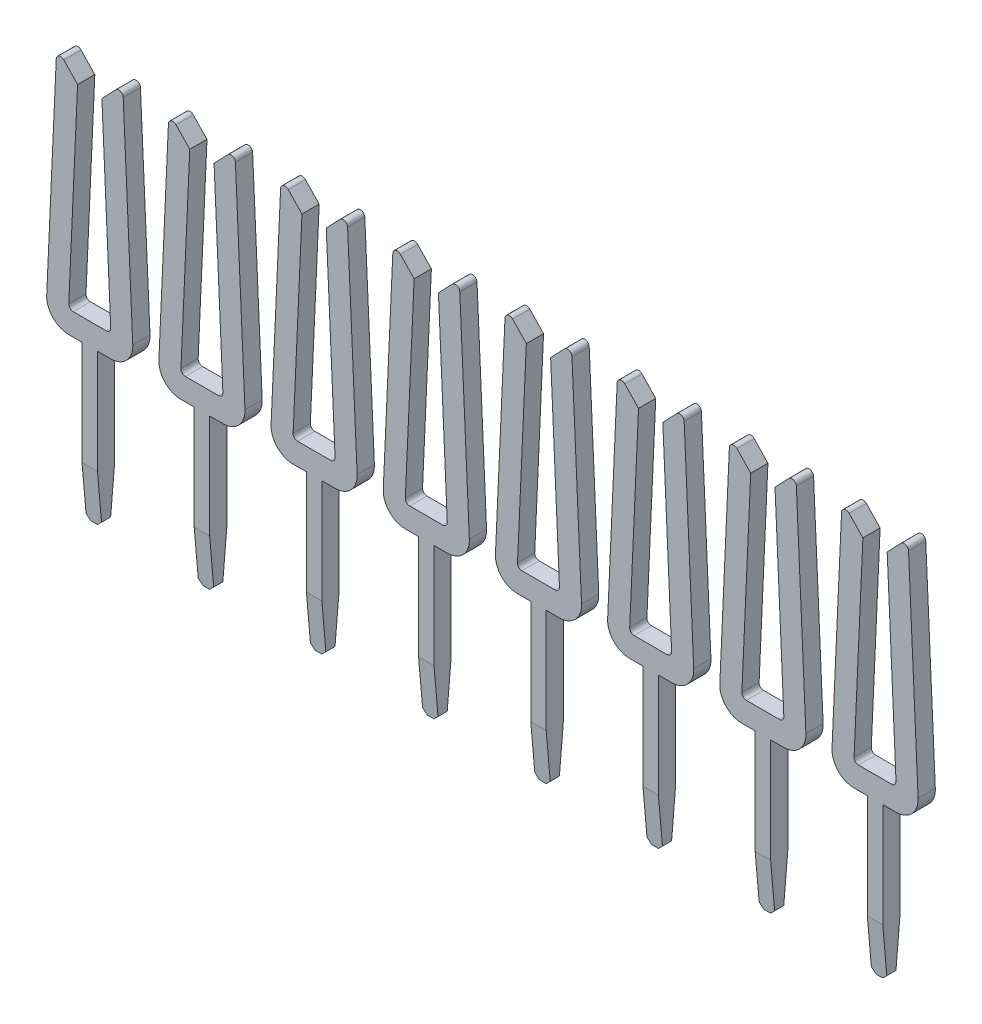
from build123d import *

# Parameters (mm, degrees)
EXTRUDE_677_DEPTH      = 0.195
CHAMFER_1_SIZE         = 0.1
CHAMFER_1_SIZE2        = 1.14300523
CHAMFER_2_SIZE         = 0.1
CHAMFER_2_SIZE2        = 1.14300523
PATTERN_LINEAR_1_COUNT = 8
PATTERN_LINEAR_1_PITCH = 2.54


with BuildPart() as part:
    # Sketch 204 → Extrude 677 (new, symmetric)
    with BuildSketch(Plane.XY):
        with BuildLine():
            Line((-0.275094226, 4.504536299), (-0.585991311, 4.829871514))
            ThreePointArc((-0.585991311, 4.829871514), (-0.693381247, 4.85442336), (-0.758184185, 4.765339295))
            Line((-0.758184185, 4.765339295), (-0.974480797, 0.022780107))
            ThreePointArc((-0.974480797, 0.022780107), (-0.836517671, -0.34540552), (-0.475, -0.5))
            Line((-0.475, -0.5), (-0.175, -0.5))
            Line((-0.175, -0.5), (-0.175, -3.9))
            Line((-0.175, -3.9), (-0.075, -4))
            Line((-0.075, -4), (0.075, -4))
            Line((0.075, -4), (0.175, -3.9))
            Line((0.175, -3.9), (0.175, -0.5))
            Line((0.175, -0.5), (0.475, -0.5))
            ThreePointArc((0.475, -0.5), (0.836517671, -0.34540552), (0.974480797, 0.022780107))
            Line((0.974480797, 0.022780107), (0.758184185, 4.765339295))
            ThreePointArc((0.758184185, 4.765339295), (0.693381247, 4.85442336), (0.585991311, 4.829871514))
            Line((0.585991311, 4.829871514), (0.275094226, 4.504536299))
            Line((0.275094226, 4.504536299), (0.474897057, 0.104536299))
            ThreePointArc((0.474897057, 0.104536299), (0.447296715, 0.030911759), (0.375, 0))
            Line((0.375, 0), (-0.375, 0))
            ThreePointArc((-0.375, 0), (-0.447296715, 0.030911759), (-0.474897057, 0.104536299))
            Line((-0.474897057, 0.104536299), (-0.275094226, 4.504536299))
        make_face()
    extrude(amount=EXTRUDE_677_DEPTH, both=True)

    # Фаска1
    chamfer_1_edges = [part.edges().sort_by_distance(p)[0] for p in [
        (0, -4, 0.195),
    ]]
    chamfer_1_side = [part.faces().sort_by_distance(p)[0] for p in [
        (0, -4, 0),
    ]]
    chamfer(chamfer_1_edges, length=CHAMFER_1_SIZE, length2=CHAMFER_1_SIZE2, reference=chamfer_1_side[0])

    # Фаска2
    chamfer_2_edges = [part.edges().sort_by_distance(p)[0] for p in [
        (0, -4, -0.195),
    ]]
    chamfer_2_side = [part.faces().sort_by_distance(p)[0] for p in [
        (0, -4, -0.05),
    ]]
    chamfer(chamfer_2_edges, length=CHAMFER_2_SIZE, length2=CHAMFER_2_SIZE2, reference=chamfer_2_side[0])


with BuildPart() as pattern_linear_1_1:
    # Линейный массив1: pattern copy
    add(part.part.moved(Location(Vector(-1, 0, 0) * (1 * PATTERN_LINEAR_1_PITCH))))


with BuildPart() as pattern_linear_1_2:
    # Линейный массив1: pattern copy
    add(part.part.moved(Location(Vector(-1, 0, 0) * (2 * PATTERN_LINEAR_1_PITCH))))


with BuildPart() as pattern_linear_1_3:
    # Линейный массив1: pattern copy
    add(part.part.moved(Location(Vector(-1, 0, 0) * (3 * PATTERN_LINEAR_1_PITCH))))


with BuildPart() as pattern_linear_1_4:
    # Линейный массив1: pattern copy
    add(part.part.moved(Location(Vector(-1, 0, 0) * (4 * PATTERN_LINEAR_1_PITCH))))


with BuildPart() as pattern_linear_1_5:
    # Линейный массив1: pattern copy
    add(part.part.moved(Location(Vector(-1, 0, 0) * (5 * PATTERN_LINEAR_1_PITCH))))


with BuildPart() as pattern_linear_1_6:
    # Линейный массив1: pattern copy
    add(part.part.moved(Location(Vector(-1, 0, 0) * (6 * PATTERN_LINEAR_1_PITCH))))


with BuildPart() as pattern_linear_1_7:
    # Линейный массив1: pattern copy
    add(part.part.moved(Location(Vector(-1, 0, 0) * (7 * PATTERN_LINEAR_1_PITCH))))


solid = Compound([part.part, pattern_linear_1_1.part, pattern_linear_1_2.part, pattern_linear_1_3.part, pattern_linear_1_4.part, pattern_linear_1_5.part, pattern_linear_1_6.part, pattern_linear_1_7.part])
